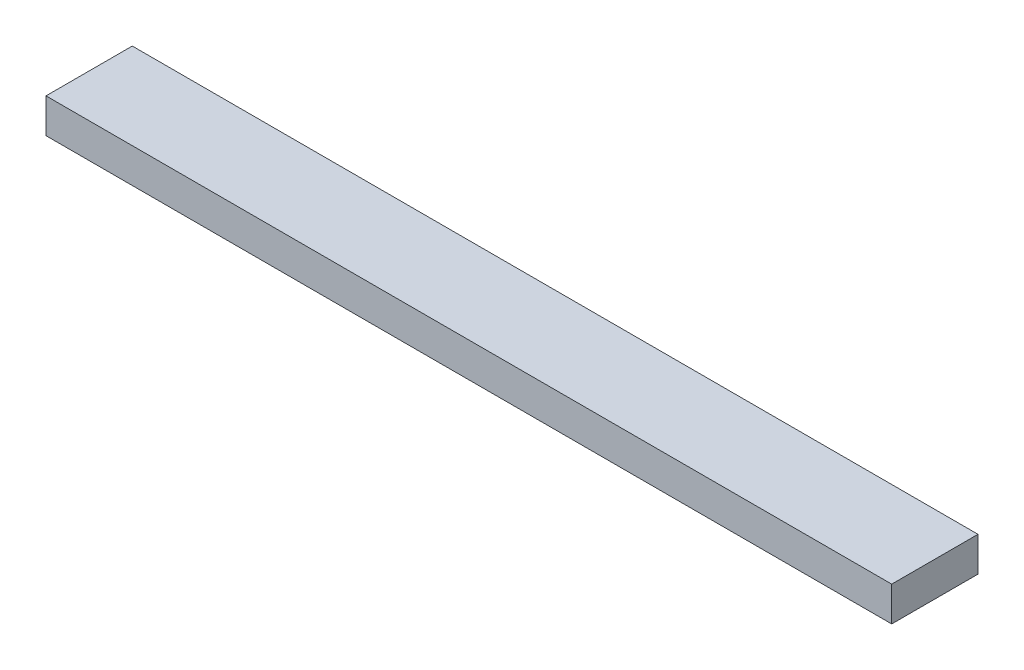
from build123d import *

# Parameters (mm, degrees)
SKETCH1_W           = 98
SKETCH1_H           = 10
BOSS_EXTRUDE1_DEPTH = 4


with BuildPart() as part:
    # Sketch1 → Boss-Extrude1 (new body)
    with BuildSketch(Plane(origin=(0, 0, 0), x_dir=(1, 0, 0), z_dir=(0, 1, 0))):
        with Locations((49, 5)):
            Rectangle(SKETCH1_W, SKETCH1_H)
    extrude(amount=BOSS_EXTRUDE1_DEPTH)


solid = part.part
